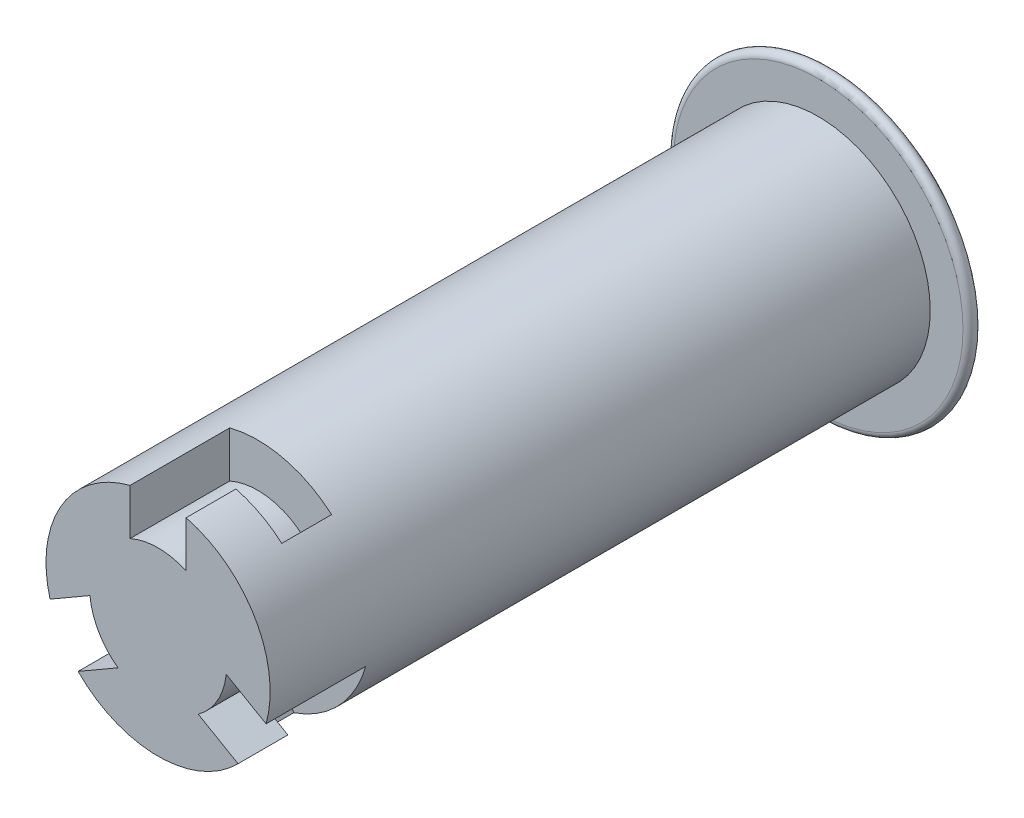
from build123d import *

# Parameters (mm, degrees)
SKETCH1_R           = 9
BOSS_EXTRUDE1_DEPTH = 53
FILLET1_R           = 0.5
CUT_EXTRUDE1_DEPTH  = 3.5
CUT_EXTRUDE2_REACH  = 54.86
CUT_EXTRUDE3_REACH  = 62.483
CUT_EXTRUDE5_START  = 4
CUT_EXTRUDE5_DEPTH  = 4


with BuildPart() as part:
    # Sketch1 → Boss-Extrude1 (new body)
    with BuildSketch(Plane.XY):
        Circle(SKETCH1_R)
    extrude(amount=BOSS_EXTRUDE1_DEPTH)

    # Sketch2 → Revolve1 (revolve)
    with BuildSketch(Plane(origin=(0, 0, 0), x_dir=(1, 0, 0), z_dir=(0, 1, 0))):
        with BuildLine():
            Line((0, 0), (0, 5))
            ThreePointArc((0, 5), (-6.964194139, 3.70690476), (-13, 0))
            Line((-13, 0), (0, 0))
        make_face()
    revolve(axis=Axis((0, 0, 0), (0, 0, -1)))

    # Fillet1
    fillet1_edges = [part.edges().sort_by_distance(p)[0] for p in [
        (13, 0, 0),
    ]]
    fillet(fillet1_edges, radius=FILLET1_R)

    # Sketch3 → Cut-Extrude1 (cut)
    with BuildSketch(Plane.XY.offset(45)):
        with BuildLine():
            Line((0, 9), (0, 6))
            ThreePointArc((0, 6), (2.390466165, 5.503241909), (4.385104527, 4.095223838))
            Line((4.385104527, 4.095223838), (5.929655352, 6.770464342))
            ThreePointArc((5.929655352, 6.770464342), (3.167476987, 8.42419667), (0, 9))
        make_face()
        with BuildLine():
            Line((7.794228634, -4.5), (5.196152423, -3))
            ThreePointArc((5.196152423, -3), (3.570714214, -4.82182538), (1.354015614, -5.845223838))
            Line((1.354015614, -5.845223838), (2.898566439, -8.520464342))
            ThreePointArc((2.898566439, -8.520464342), (5.711829829, -6.955213872), (7.794228634, -4.5))
        make_face()
        with BuildLine():
            Line((-7.794228634, -4.5), (-5.196152423, -3))
            ThreePointArc((-5.196152423, -3), (-5.961180379, -0.681416529), (-5.739120142, 1.75))
            Line((-5.739120142, 1.75), (-8.828221792, 1.75))
            ThreePointArc((-8.828221792, 1.75), (-8.879306816, -1.468982799), (-7.794228634, -4.5))
        make_face()
    extrude(amount=CUT_EXTRUDE1_DEPTH, mode=Mode.SUBTRACT)

    # Sketch4 → Cut-Extrude2 (cut, up to next)
    with BuildSketch(Plane.XY.offset(45), mode=Mode.PRIVATE) as cut_extrude2_sk1:
        with BuildLine():
            ThreePointArc((-1.75, 5.739120142), (-0.88466919, 5.934421659), (0, 6))
            Line((0, 6), (0, 9))
            ThreePointArc((0, 9), (-0.879205288, 8.956952499), (-1.75, 8.828221792))
            Line((-1.75, 8.828221792), (-1.75, 5.739120142))
        make_face()
    cut_extrude2_tool1 = extrude(cut_extrude2_sk1.sketch, amount=CUT_EXTRUDE2_REACH, mode=Mode.PRIVATE) & part.part
    # Sketch4 → Cut-Extrude2 (cut, up to next)
    with BuildSketch(Plane.XY.offset(45), mode=Mode.PRIVATE) as cut_extrude2_sk2:
        with BuildLine():
            ThreePointArc((0, 6), (0.88466919, 5.934421659), (1.75, 5.739120142))
            Line((1.75, 5.739120142), (1.75, 8.828221792))
            ThreePointArc((1.75, 8.828221792), (0.879205288, 8.956952499), (0, 9))
            Line((0, 9), (0, 6))
        make_face()
    cut_extrude2_tool2 = extrude(cut_extrude2_sk2.sketch, amount=CUT_EXTRUDE2_REACH, mode=Mode.PRIVATE) & part.part
    # Sketch4 → Cut-Extrude2 (cut, up to next)
    with BuildSketch(Plane.XY.offset(45), mode=Mode.PRIVATE) as cut_extrude2_sk3:
        with BuildLine():
            ThreePointArc((6.770464342, -5.929655352), (7.794228634, -4.5), (8.520464342, -2.898566439))
            Line((8.520464342, -2.898566439), (5.845223838, -1.354015614))
            ThreePointArc((5.845223838, -1.354015614), (5.196152423, -3), (4.095223838, -4.385104527))
            Line((4.095223838, -4.385104527), (6.770464342, -5.929655352))
        make_face()
    cut_extrude2_tool3 = extrude(cut_extrude2_sk3.sketch, amount=CUT_EXTRUDE2_REACH, mode=Mode.PRIVATE) & part.part
    # Sketch4 → Cut-Extrude2 (cut, up to next)
    with BuildSketch(Plane.XY.offset(45), mode=Mode.PRIVATE) as cut_extrude2_sk4:
        with BuildLine():
            ThreePointArc((-8.520464342, -2.898566439), (-7.794228634, -4.5), (-6.770464342, -5.929655352))
            Line((-6.770464342, -5.929655352), (-4.095223838, -4.385104527))
            ThreePointArc((-4.095223838, -4.385104527), (-5.196152423, -3), (-5.845223838, -1.354015614))
            Line((-5.845223838, -1.354015614), (-8.520464342, -2.898566439))
        make_face()
    cut_extrude2_tool4 = extrude(cut_extrude2_sk4.sketch, amount=CUT_EXTRUDE2_REACH, mode=Mode.PRIVATE) & part.part
    add(cut_extrude2_tool1.solids().sort_by_distance((-0.879249, 7.427825, 45))[0], mode=Mode.SUBTRACT)
    add(cut_extrude2_tool2.solids().sort_by_distance((0.879249, 7.427825, 45))[0], mode=Mode.SUBTRACT)
    add(cut_extrude2_tool3.solids().sort_by_distance((6.432686, -3.713913, 45))[0], mode=Mode.SUBTRACT)
    add(cut_extrude2_tool4.solids().sort_by_distance((-6.432686, -3.713913, 45))[0], mode=Mode.SUBTRACT)

    # Cut-Extrude3: up to this face of the body (flat: up to its plane)
    cut_extrude3_end = Plane(part.part.faces().sort_by_distance((1.875205052, 6.99836053, 45))[0])
    # Sketch5 → Cut-Extrude3 (cut, up to the picked face)
    with BuildSketch(Plane.XY.offset(53), mode=Mode.PRIVATE) as cut_extrude3_sk1:
        with BuildLine():
            ThreePointArc((-1.75, 8.828221792), (-2.000812217, 8.774779226), (-2.25, 8.714212529))
            Line((-2.25, 8.714212529), (-2.25, 5.018714975))
            ThreePointArc((-2.25, 5.018714975), (0, 5.5), (2.25, 5.018714975))
            Line((2.25, 5.018714975), (2.25, 8.714212529))
            ThreePointArc((2.25, 8.714212529), (2.000812217, 8.774779226), (1.75, 8.828221792))
            Line((1.75, 8.828221792), (1.75, 5.739120142))
            ThreePointArc((1.75, 5.739120142), (0, 6), (-1.75, 5.739120142))
            Line((-1.75, 5.739120142), (-1.75, 8.828221792))
        make_face()
    cut_extrude3_tool1 = split(extrude(cut_extrude3_sk1.sketch, amount=-CUT_EXTRUDE3_REACH, mode=Mode.PRIVATE), bisect_by=cut_extrude3_end, keep=Keep.BOTH, mode=Mode.PRIVATE)
    # Sketch5 → Cut-Extrude3 (cut, up to the picked face)
    with BuildSketch(Plane.XY.offset(53), mode=Mode.PRIVATE) as cut_extrude3_sk2:
        with BuildLine():
            Line((-5.471334663, -0.560800329), (-8.671729424, -2.408549106))
            ThreePointArc((-8.671729424, -2.408549106), (-8.599587831, -2.654635405), (-8.520464342, -2.898566439))
            Line((-8.520464342, -2.898566439), (-5.845223838, -1.354015614))
            ThreePointArc((-5.845223838, -1.354015614), (-5.196152423, -3), (-4.095223838, -4.385104527))
            Line((-4.095223838, -4.385104527), (-6.770464342, -5.929655352))
            ThreePointArc((-6.770464342, -5.929655352), (-6.598775614, -6.120143821), (-6.421729424, -6.305663423))
            Line((-6.421729424, -6.305663423), (-3.221334663, -4.457914646))
            ThreePointArc((-3.221334663, -4.457914646), (-4.763139721, -2.75), (-5.471334663, -0.560800329))
        make_face()
    cut_extrude3_tool2 = split(extrude(cut_extrude3_sk2.sketch, amount=-CUT_EXTRUDE3_REACH, mode=Mode.PRIVATE), bisect_by=cut_extrude3_end, keep=Keep.BOTH, mode=Mode.PRIVATE)
    # Sketch5 → Cut-Extrude3 (cut, up to the picked face)
    with BuildSketch(Plane.XY.offset(53), mode=Mode.PRIVATE) as cut_extrude3_sk3:
        with BuildLine():
            ThreePointArc((8.520464342, -2.898566439), (8.599587831, -2.654635405), (8.671729424, -2.408549106))
            Line((8.671729424, -2.408549106), (5.471334663, -0.560800329))
            ThreePointArc((5.471334663, -0.560800329), (4.763139721, -2.75), (3.221334663, -4.457914646))
            Line((3.221334663, -4.457914646), (6.421729424, -6.305663423))
            ThreePointArc((6.421729424, -6.305663423), (6.598775614, -6.120143821), (6.770464342, -5.929655352))
            Line((6.770464342, -5.929655352), (4.095223838, -4.385104527))
            ThreePointArc((4.095223838, -4.385104527), (5.196152423, -3), (5.845223838, -1.354015614))
            Line((5.845223838, -1.354015614), (8.520464342, -2.898566439))
        make_face()
    cut_extrude3_tool3 = split(extrude(cut_extrude3_sk3.sketch, amount=-CUT_EXTRUDE3_REACH, mode=Mode.PRIVATE), bisect_by=cut_extrude3_end, keep=Keep.BOTH, mode=Mode.PRIVATE)
    add(cut_extrude3_tool1.solids().sort_by(Axis((1.987705, 8.717295, 53), (0, 0, -1)))[0], mode=Mode.SUBTRACT)
    add(cut_extrude3_tool2.solids().sort_by(Axis((-4.861127, -5.313209, 53), (0, 0, -1)))[0], mode=Mode.SUBTRACT)
    add(cut_extrude3_tool3.solids().sort_by(Axis((8.523921, -2.631278, 53), (0, 0, -1)))[0], mode=Mode.SUBTRACT)

    # Sketch6 → Cut-Extrude5 (cut)
    with BuildSketch(Plane.XY.offset(45).offset(CUT_EXTRUDE5_START)):
        with BuildLine():
            ThreePointArc((-2.25, 5.018714975), (0, 5.5), (2.25, 5.018714975))
            Line((2.25, 5.018714975), (2.25, 5.562148865))
            ThreePointArc((2.25, 5.562148865), (3.397663945, 4.945288639), (4.385104527, 4.095223838))
            Line((4.385104527, 4.095223838), (5.929655352, 6.770464342))
            ThreePointArc((5.929655352, 6.770464342), (2.080746292, 8.756168961), (-2.25, 8.714212529))
            Line((-2.25, 8.714212529), (-2.25, 5.018714975))
        make_face()
        with BuildLine():
            ThreePointArc((5.471334663, -0.560800329), (4.074255543, -3.694650426), (1.091537245, -5.390597967))
            Line((1.091537245, -5.390597967), (1.354015614, -5.845223838))
            Line((1.354015614, -5.845223838), (2.898566439, -8.520464342))
            ThreePointArc((2.898566439, -8.520464342), (6.542691614, -6.180063628), (8.671729424, -2.408549106))
            Line((8.671729424, -2.408549106), (5.471334663, -0.560800329))
        make_face()
        with BuildLine():
            ThreePointArc((-3.221334663, -4.457914646), (-5.236788899, -1.681083588), (-5.214163404, 1.75))
            Line((-5.214163404, 1.75), (-5.739120142, 1.75))
            Line((-5.739120142, 1.75), (-8.828221792, 1.75))
            ThreePointArc((-8.828221792, 1.75), (-8.623437906, -2.576105333), (-6.421729424, -6.305663423))
            Line((-6.421729424, -6.305663423), (-3.221334663, -4.457914646))
        make_face()
        with BuildLine():
            Line((2.25, 5.562148865), (2.25, 5.018714975))
            ThreePointArc((2.25, 5.018714975), (3.259968199, 4.429741227), (4.122626158, 3.640597967))
            Line((4.122626158, 3.640597967), (4.385104527, 4.095223838))
            ThreePointArc((4.385104527, 4.095223838), (3.397663945, 4.945288639), (2.25, 5.562148865))
        make_face()
    extrude(amount=-CUT_EXTRUDE5_DEPTH, mode=Mode.SUBTRACT)


solid = part.part
